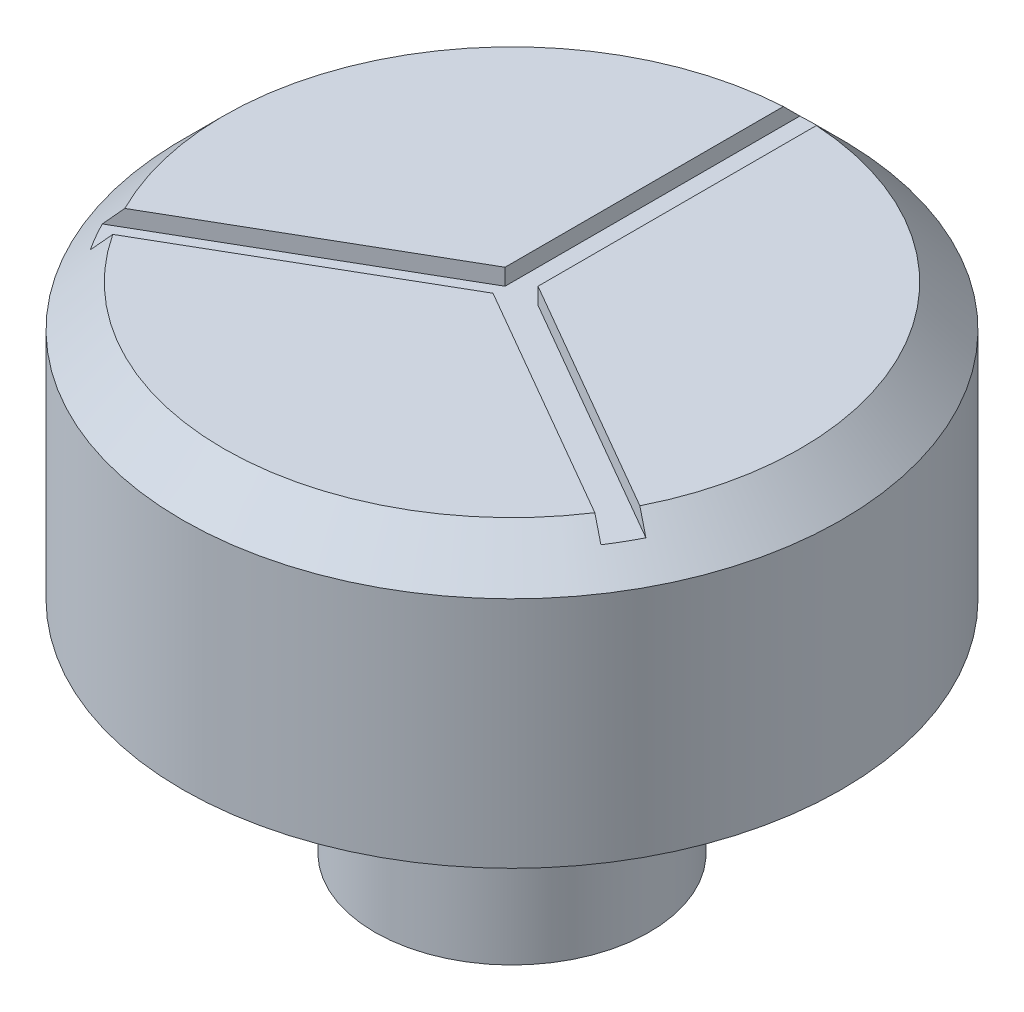
from build123d import *

# Parameters (mm, degrees)
SKETCH1_R           = 25
BOSS_EXTRUDE1_DEPTH = 40
SKETCH2_R           = 60
BOSS_EXTRUDE2_DEPTH = 50
CHAMFER1_SIZE       = 7.5
CUT_EXTRUDE1_DEPTH  = 3


with BuildPart() as part:
    # Sketch1 → Boss-Extrude1 (new body)
    with BuildSketch(Plane(origin=(0, 0, 0), x_dir=(1, 0, 0), z_dir=(0, 1, 0))):
        with Locations(Location((0, 0, 0), (0, 0, 270))):
            Circle(SKETCH1_R)
    extrude(amount=BOSS_EXTRUDE1_DEPTH)

    # Sketch2 → Boss-Extrude2 (add)
    with BuildSketch(Plane(origin=(0, 40, 0), x_dir=(1, 0, 0), z_dir=(0, 1, 0))):
        with Locations(Location((0, 0, 0), (0, 0, 270))):
            Circle(SKETCH2_R)
    extrude(amount=BOSS_EXTRUDE2_DEPTH)

    # Chamfer1
    chamfer1_edges = [part.edges().sort_by_distance(p)[0] for p in [
        (0, 90, -60),
    ]]
    chamfer(chamfer1_edges, length=CHAMFER1_SIZE)

    # Sketch3 → Cut-Extrude1 (cut)
    with BuildSketch(Plane(origin=(0, 90, 0), x_dir=(1, 0, 0), z_dir=(0, 1, 0))):
        with BuildLine():
            Line((-3, 1.732050808), (-53.461524227, -27.401923789))
            ThreePointArc((-53.461524227, -27.401923789), (-54.559600438, -31.5), (-50.461524227, -32.598076211))
            Line((-50.461524227, -32.598076211), (0, -3.464101615))
            Line((0, -3.464101615), (50.461524227, -32.598076211))
            ThreePointArc((50.461524227, -32.598076211), (54.559600438, -31.5), (53.461524227, -27.401923789))
            Line((53.461524227, -27.401923789), (3, 1.732050808))
            Line((3, 1.732050808), (3, 60))
            ThreePointArc((3, 60), (0, 63), (-3, 60))
            Line((-3, 60), (-3, 1.732050808))
        make_face()
    extrude(amount=-CUT_EXTRUDE1_DEPTH, mode=Mode.SUBTRACT)


solid = part.part
